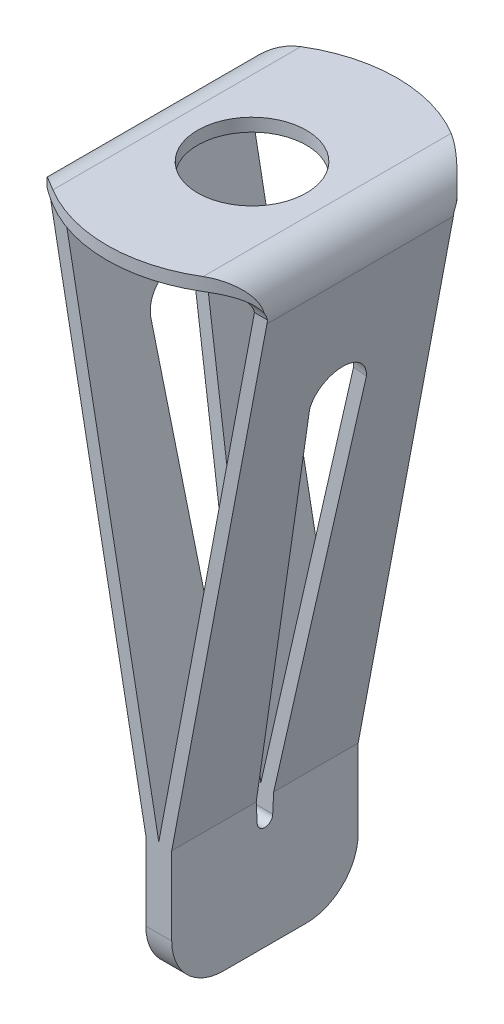
from build123d import *

# Parameters (mm, degrees)
ESBO_O1_R                = 1.05
RESSALTO_EXTRUS_O1_DEPTH = 0.25
RESSALTO_EXTRUS_O2_DEPTH = 1.8
FILETE1_R                = 1
RESSALTO_EXTRUS_O4_DEPTH = 2
CORTE_EXTRUS_O6_DEPTH    = 5
ESBO_O5_R                = 1.05
RESSALTO_EXTRUS_O3_DEPTH = 0.7
CORTE_EXTRUS_O1_DEPTH    = 5
CORTE_EXTRUS_O2_DEPTH    = 15


with BuildPart() as part:
    # Esboço1 → Ressalto-extrusão1 (new body)
    with BuildSketch(Plane(origin=(0, 0, 0), x_dir=(1, 0, 0), z_dir=(0, 1, 0))):
        with BuildLine():
            Line((2.079062289, 1.8), (14, 1.8))
            ThreePointArc((14, 1.8), (14.707106781, 1.507106781), (15, 0.8))
            Line((15, 0.8), (15, -0.8))
            ThreePointArc((15, -0.8), (14.707106781, -1.507106781), (14, -1.8))
            Line((14, -1.8), (2.079062289, -1.8))
            ThreePointArc((2.079062289, -1.8), (0, -2.75), (-2.079062289, -1.8))
            Line((-2.079062289, -1.8), (-14, -1.8))
            ThreePointArc((-14, -1.8), (-14.707106781, -1.507106781), (-15, -0.8))
            Line((-15, -0.8), (-15, 0.8))
            ThreePointArc((-15, 0.8), (-14.707106781, 1.507106781), (-14, 1.8))
            Line((-14, 1.8), (-2.079062289, 1.8))
            ThreePointArc((-2.079062289, 1.8), (0, 2.75), (2.079062289, 1.8))
        make_face()
        with Locations(Location((0, 0, 0), (0, 0, 270))):
            Circle(ESBO_O1_R, mode=Mode.SUBTRACT)
        with BuildLine():
            Line((4.978511643, 0.549893952), (12.857420168, 0.15))
            ThreePointArc((12.857420168, 0.15), (13, 0), (12.857420168, -0.15))
            Line((12.857420168, -0.15), (4.978511643, -0.549893952))
            ThreePointArc((4.978511643, -0.549893952), (4.4, 0), (4.978511643, 0.549893952))
        make_face(mode=Mode.SUBTRACT)
        with BuildLine():
            Line((-12.857420168, -0.15), (-4.978511643, -0.549893952))
            ThreePointArc((-4.978511643, -0.549893952), (-4.4, 0), (-4.978511643, 0.549893952))
            Line((-4.978511643, 0.549893952), (-12.857420168, 0.15))
            ThreePointArc((-12.857420168, 0.15), (-13, 0), (-12.857420168, -0.15))
        make_face(mode=Mode.SUBTRACT)
    extrude(amount=RESSALTO_EXTRUS_O1_DEPTH)


with BuildPart() as body_2:
    # Esboço4 → Ressalto-extrusão2 (new, symmetric)
    with BuildSketch(Plane.XY):
        with BuildLine():
            Line((0, -10.226584075), (0, -12.76))
            Line((0, -12.76), (-0.25, -12.76))
            Line((-0.25, -12.76), (-0.25, -10.25))
            Line((-0.25, -10.25), (-2.088694427, -0.52070389))
            ThreePointArc((-2.088694427, -0.52070389), (-1.950478535, 0.014754428), (-1.45, 0.25))
            Line((-1.45, 0.25), (-1.45, 0))
            ThreePointArc((-1.45, 0), (-1.757986791, -0.144766506), (-1.843042724, -0.474279317))
            Line((-1.843042724, -0.474279317), (0, -10.226584075))
        make_face()
    extrude(amount=RESSALTO_EXTRUS_O2_DEPTH, both=True)

    # Filete1
    filete1_edges = [body_2.edges().sort_by_distance(p)[0] for p in [
        (-0.125, -12.76, 1.8),
        (-0.125, -12.76, -1.8),
    ]]
    fillet(filete1_edges, radius=FILETE1_R)


with BuildPart() as body_3:
    # Esboço16 → Ressalto-extrusão4 (new, symmetric)
    with BuildSketch(Plane.ZY.offset(0.25)):
        with BuildLine():
            Line((0.15, -10.61), (0.549854071, -2.738494336))
            ThreePointArc((0.549854071, -2.738494336), (0, -2.16), (-0.549854071, -2.738494336))
            Line((-0.549854071, -2.738494336), (-0.15, -10.61))
            ThreePointArc((-0.15, -10.61), (0, -10.76), (0.15, -10.61))
        make_face()
    extrude(amount=RESSALTO_EXTRUS_O4_DEPTH, both=True)

    # Esboço17 → Corte-extrusão6 (cut, symmetric)
    with BuildSketch(Plane(origin=(-2.111680199, -0.399076621, 0), x_dir=(0, 0, 1), z_dir=(-0.9826068107203668, -0.18569829166136476, 0))):
        with BuildLine():
            Line((-0.55, -2.513436729), (-0.175, -10.025295237))
            Line((-0.175, -10.025295237), (-1.291075027, -10.025295237))
            Line((-1.291075027, -10.025295237), (-1.291075027, -1.561962936))
            Line((-1.291075027, -1.561962936), (1.201455883, -1.561962936))
            Line((1.201455883, -1.561962936), (1.201455883, -10.025295237))
            Line((1.201455883, -10.025295237), (0.175, -10.025295237))
            Line((0.175, -10.025295237), (0.55, -2.513436729))
            ThreePointArc((0.55, -2.513436729), (0, -1.935295237), (-0.55, -2.513436729))
        make_face()
    extrude(amount=CORTE_EXTRUS_O6_DEPTH, both=True, mode=Mode.SUBTRACT)


with BuildPart() as body_2_1:
    add(body_2.part)

    # Combinar2: cut body 3
    add(body_3.part, mode=Mode.SUBTRACT)


with BuildPart() as body_3_2:
    # Espelhar1: mirrored copy
    add(body_2_1.part.mirror(Plane(origin=(0, 0, 0), x_dir=(0, 0, 1), z_dir=(1, 0, 0))))


with BuildPart() as body_4:
    # Esboço5 → Ressalto-extrusão3 (new body)
    with BuildSketch(Plane(origin=(0, 0.25, 0), x_dir=(1, 0, 0), z_dir=(0, 1, 0))):
        with BuildLine():
            Line((-2.1, 1.852025918), (-2.1, -1.852025918))
            ThreePointArc((-2.1, -1.852025918), (0, -2.8), (2.1, -1.852025918))
            Line((2.1, -1.852025918), (2.1, 1.852025918))
            ThreePointArc((2.1, 1.852025918), (0, 2.8), (-2.1, 1.852025918))
        make_face()
        with Locations(Location((0, 0, 0), (0, 0, 270))):
            Circle(ESBO_O5_R, mode=Mode.SUBTRACT)
    extrude(amount=-RESSALTO_EXTRUS_O3_DEPTH)

    # Esboço6 → Corte-extrusão1 (cut, symmetric)
    with BuildSketch(Plane.XY):
        with BuildLine():
            Line((-1.45, 0.25), (-1.45, 0.597201145))
            Line((-1.45, 0.597201145), (-2.428627535, 0.597201145))
            Line((-2.428627535, 0.597201145), (-2.428627535, -0.52070389))
            Line((-2.428627535, -0.52070389), (-2.088694427, -0.52070389))
            ThreePointArc((-2.088694427, -0.52070389), (-1.950478535, 0.014754428), (-1.45, 0.25))
        make_face()
        with BuildLine():
            Line((1.45, 0.25), (1.45, 0.729701811))
            Line((1.45, 0.729701811), (2.688745217, 0.729701811))
            Line((2.688745217, 0.729701811), (2.688745217, -0.52070389))
            Line((2.688745217, -0.52070389), (2.088694427, -0.52070389))
            ThreePointArc((2.088694427, -0.52070389), (1.950478535, 0.014754428), (1.45, 0.25))
        make_face()
        with BuildLine():
            Line((-1.45, 0), (1.45, 0))
            ThreePointArc((1.45, 0), (1.757986791, -0.144766506), (1.843042724, -0.474279317))
            Line((1.843042724, -0.474279317), (-1.843042724, -0.474279317))
            ThreePointArc((-1.843042724, -0.474279317), (-1.757986791, -0.144766506), (-1.45, 0))
        make_face()
    extrude(amount=CORTE_EXTRUS_O1_DEPTH, both=True, mode=Mode.SUBTRACT)

    # Combinar1: union body 3 2, body 2
    add(body_3_2.part)
    add(body_2_1.part)

    # Esboço7 → Corte-extrusão2 (cut, symmetric)
    with BuildSketch(Plane(origin=(0, 0, 0), x_dir=(0, 0, -1), z_dir=(1, 0, 0))):
        with BuildLine():
            Line((2.395307913, 0), (3.16000301, 0))
            Line((3.16000301, 0), (3.16000301, -0.618768346))
            Line((3.16000301, -0.618768346), (1.8, -0.618768346))
            Line((1.8, -0.618768346), (1.8, -0.45))
            ThreePointArc((1.8, -0.45), (2.022182093, -0.125157783), (2.395307913, 0))
        make_face()
        with BuildLine():
            Line((-1.8, -0.45), (-1.8, -0.594962274))
            Line((-1.8, -0.594962274), (-2.989404484, -0.594962274))
            Line((-2.989404484, -0.594962274), (-2.989404484, 0))
            Line((-2.989404484, 0), (-2.395307913, 0))
            ThreePointArc((-2.395307913, 0), (-2.022182093, -0.125157783), (-1.8, -0.45))
        make_face()
    extrude(amount=CORTE_EXTRUS_O2_DEPTH, both=True, mode=Mode.SUBTRACT)


solid = body_4.part
